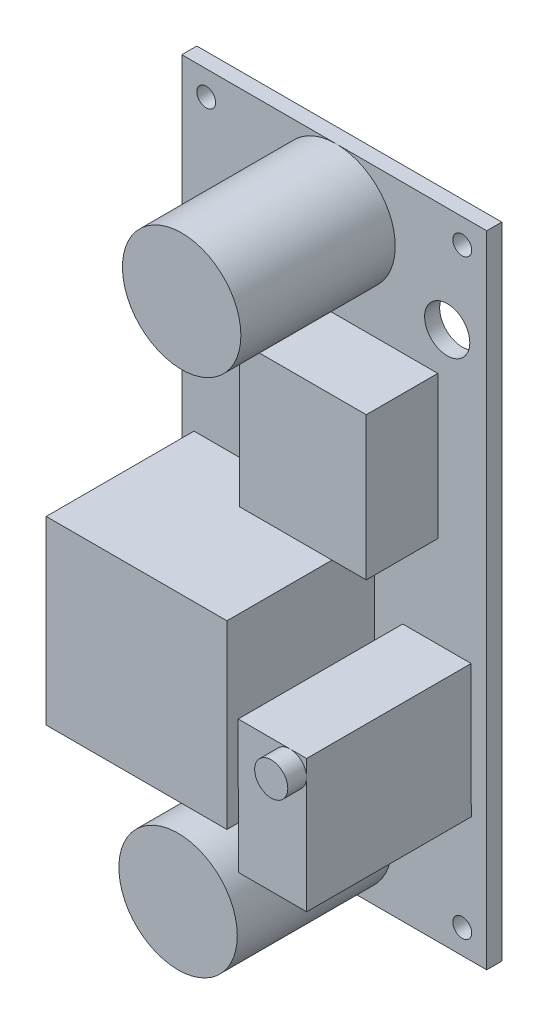
from build123d import *

# Parameters (mm, degrees)
SKETCH1_W           = 20.574
SKETCH1_H           = 43.18
BOSS_EXTRUDE1_DEPTH = 1.016
SKETCH2_R           = 1.524
CUT_EXTRUDE1_DEPTH  = 48.841761381
SKETCH3_R           = 0.635
CUT_EXTRUDE2_DEPTH  = 2.54
SKETCH4_W           = 0.79375
SKETCH4_H           = 0.071233975
SKETCH4_W_2         = 0.081410257
SKETCH4_H_2         = 0.305288462
SKETCH4_H_3         = 0.071233974
BOSS_EXTRUDE2_DEPTH = 0.00254
SKETCH5_W           = 12.192
SKETCH5_H           = 12.192
BOSS_EXTRUDE3_DEPTH = 9.9695
SKETCH6_R           = 3.99415
BOSS_EXTRUDE4_DEPTH = 10.414
BOSS_EXTRUDE5_DEPTH = 11.0998
SKETCH8_R           = 1.1176
BOSS_EXTRUDE6_DEPTH = 1.27
SKETCH9_W           = 8.5344
SKETCH9_H           = 9.652
BOSS_EXTRUDE7_DEPTH = 4.826


with BuildPart() as part:
    # Sketch1 → Boss-Extrude1 (new body)
    with BuildSketch(Plane.XY):
        with Locations((10.287, 21.59)):
            Rectangle(SKETCH1_W, SKETCH1_H)
    extrude(amount=BOSS_EXTRUDE1_DEPTH)

    # Sketch2 → Cut-Extrude1 (cut, through all)
    with BuildSketch(Plane.XY.offset(1.016)):
        with Locations((17.907, 36.068)):
            Circle(SKETCH2_R)
        with Locations((3.0988, 6.35)):
            Circle(SKETCH2_R)
    extrude(amount=-CUT_EXTRUDE1_DEPTH, mode=Mode.SUBTRACT)

    # Sketch3 → Cut-Extrude2 (cut)
    with BuildSketch(Plane.XY.offset(1.016)):
        with Locations((18.923, 41.529)):
            Circle(SKETCH3_R)
        with Locations((18.923, 1.651)):
            Circle(SKETCH3_R)
        with Locations((1.651, 1.651)):
            Circle(SKETCH3_R)
        with Locations((1.651, 41.529)):
            Circle(SKETCH3_R)
    extrude(amount=-CUT_EXTRUDE2_DEPTH, mode=Mode.SUBTRACT)

    # Sketch4 → Boss-Extrude2 (add)
    # profile 1 of 14: a face of its own
    with BuildSketch(Plane(origin=(0, 0, 0), x_dir=(-1, 0, 0), z_dir=(0, 0, -1))):
        Polygon((-17.848673525, 42.286725962), (-18.082728012, 42.286725962), (-18.082728012, 42.357959936), (-17.848673525, 42.357959936), (-17.848673525, 42.592014423), (-17.777439551, 42.592014423), (-17.777439551, 42.357959936), (-17.543385063, 42.357959936), (-17.543385063, 42.286725962), (-17.777439551, 42.286725962), (-17.777439551, 42.052671474), (-17.848673525, 42.052671474), align=None)
    # profile 2 of 14: a face of its own
    with BuildSketch(Plane(origin=(0, 0, 0), x_dir=(-1, 0, 0), z_dir=(0, 0, -1))):
        Polygon((-17.421269679, 41.279274038), (-18.215019679, 41.279274038), (-18.215019679, 41.294220453), (-17.590291363, 41.818616987), (-18.215019679, 41.818616987), (-18.215019679, 41.889850962), (-17.421269679, 41.889850962), (-17.421269679, 41.873632512), (-18.044566954, 41.350508013), (-17.421269679, 41.350508013), align=None)
    # profile 3 of 14: a face of its own
    with BuildSketch(Plane(origin=(0, 0, 0), x_dir=(-1, 0, 0), z_dir=(0, 0, -1))):
        with Locations((-17.818144679, 41.070660257)):
            Rectangle(SKETCH4_W, SKETCH4_H)
    # profile 4 of 14: a face of its own
    with BuildSketch(Plane(origin=(0, 0, 0), x_dir=(-1, 0, 0), z_dir=(0, 0, -1))):
        with Locations((-2.746900665, 42.32743109)):
            Rectangle(SKETCH4_W_2, SKETCH4_H_2)
    # profile 5 of 14: a face of its own
    with BuildSketch(Plane(origin=(0, 0, 0), x_dir=(-1, 0, 0), z_dir=(0, 0, -1))):
        Polygon((-2.441612203, 41.431918269), (-3.235362203, 41.431918269), (-3.235362203, 41.446864683), (-2.610633888, 41.971261218), (-3.235362203, 41.971261218), (-3.235362203, 42.042495192), (-2.441612203, 42.042495192), (-2.441612203, 42.026276743), (-3.064909479, 41.503152244), (-2.441612203, 41.503152244), align=None)
    # profile 6 of 14: a face of its own
    with BuildSketch(Plane(origin=(0, 0, 0), x_dir=(-1, 0, 0), z_dir=(0, 0, -1))):
        with Locations((-2.838487203, 41.223304487)):
            Rectangle(SKETCH4_W, SKETCH4_H_3)
    # profile 7 of 14: a face of its own
    with BuildSketch(Plane(origin=(0, 0, 0), x_dir=(-1, 0, 0), z_dir=(0, 0, -1))):
        with BuildLine():
            add(Edge.make_bspline(
                [(-18.235372243, 1.075856171), (-18.235006246, 1.090555326), (-18.234287397, 1.11942568), (-18.228603062, 1.161816811), (-18.21924724, 1.202408219), (-18.206034822, 1.241223241), (-18.188906583, 1.278114253), (-18.168100678, 1.313185445), (-18.143490664, 1.346331712), (-18.115437918, 1.377324896), (-18.084715583, 1.405597859), (-18.05182674, 1.430407531), (-18.017184889, 1.451336831), (-17.980788224, 1.468469742), (-17.94272172, 1.481920213), (-17.902772035, 1.491199415), (-17.861200825, 1.497127353), (-17.832846501, 1.497820335), (-17.818462688, 1.498171876)],
                knots=[0, 0, 0, 0, 1.065064174, 2.09187391, 3.093564831, 4.079973196, 5.057907931, 6.036227367, 7.030399151, 8.044883615, 9.061699972, 10.052012555, 11.025713132, 11.989727027, 12.962874294, 13.945865945, 14.957962116, 16, 16, 16, 16], degree=3))
            add(Edge.make_bspline(
                [(-17.818462688, 1.498171876), (-17.804184912, 1.497820217), (-17.776041763, 1.497127054), (-17.734733171, 1.491194605), (-17.695028998, 1.481878809), (-17.65701774, 1.468636278), (-17.620694998, 1.451490219), (-17.586026922, 1.430530108), (-17.553050233, 1.405767522), (-17.522116245, 1.37761462), (-17.493818809, 1.346833758), (-17.468859368, 1.314071317), (-17.447920958, 1.27943039), (-17.430596773, 1.24326996), (-17.417426608, 1.205306084), (-17.407838293, 1.165815025), (-17.401969203, 1.124581624), (-17.401271659, 1.096493068), (-17.400917115, 1.082216348)],
                knots=[0, 0, 0, 0, 1.043748596, 2.057349401, 3.045489418, 4.02252776, 4.995289225, 5.97782527, 6.980224157, 8.006516136, 9.032559198, 10.034193337, 11.013412982, 11.987833483, 12.961212594, 13.946489799, 14.956251404, 16, 16, 16, 16], degree=3))
            add(Edge.make_bspline(
                [(-17.400917115, 1.082216348), (-17.401268493, 1.067832618), (-17.401961155, 1.039478458), (-17.407898723, 0.997854881), (-17.417183626, 0.957877607), (-17.43045273, 0.919660959), (-17.447601638, 0.883183627), (-17.468512274, 0.848374269), (-17.493324251, 0.815372605), (-17.521483456, 0.784452245), (-17.552138433, 0.756160909), (-17.584984773, 0.731495836), (-17.619378064, 0.710580498), (-17.655413752, 0.693489171), (-17.692917633, 0.679958124), (-17.732139877, 0.670726852), (-17.772856872, 0.664754235), (-17.800579815, 0.664065975), (-17.814646582, 0.663716748)],
                knots=[0, 0, 0, 0, 1.053102029, 2.075944431, 3.073151272, 4.055350789, 5.033113405, 6.020478099, 7.024410459, 8.052272461, 9.079885166, 10.07527673, 11.055994387, 12.023226415, 12.992069828, 13.970394897, 14.97016774, 16, 16, 16, 16], degree=3))
            add(Edge.make_bspline(
                [(-17.814646582, 0.663716748), (-17.824088276, 0.663837996), (-17.842852554, 0.664078962), (-17.870716944, 0.666979935), (-17.898133218, 0.671189464), (-17.925023415, 0.677222397), (-17.95132171, 0.68511265), (-17.977209472, 0.694422664), (-18.002424353, 0.705793664), (-18.0270858, 0.718648026), (-18.050809379, 0.7329949), (-18.073233856, 0.748841722), (-18.094547403, 0.765631886), (-18.114197706, 0.784038584), (-18.13275641, 0.80345517), (-18.149938312, 0.824196624), (-18.165898346, 0.846136383), (-18.180281173, 0.869368851), (-18.193289405, 0.893321567), (-18.204452218, 0.918013265), (-18.214033021, 0.943108595), (-18.221798351, 0.968725095), (-18.227928831, 0.994794742), (-18.232103356, 1.021374432), (-18.235011728, 1.048442991), (-18.235251554, 1.06667913), (-18.235372243, 1.075856171)],
                knots=[0, 0, 0, 0, 1.037015668, 2.060948919, 3.074880161, 4.083647147, 5.086022904, 6.090072063, 7.104153813, 8.122640571, 9.144368836, 10.147691507, 11.138137339, 12.123020368, 13.103399296, 14.087645067, 15.080126199, 16.082011238, 17.087798457, 18.072939717, 19.057185487, 20.037253025, 21.01195951, 21.997135196, 22.992090687, 24, 24, 24, 24], degree=3))
        make_face()
        with BuildLine():
            add(Edge.make_bspline(
                [(-18.153961986, 1.079354268), (-18.153870483, 1.071821568), (-18.153688352, 1.056828179), (-18.151276124, 1.034540075), (-18.14786271, 1.012538327), (-18.142905235, 0.990865513), (-18.136492957, 0.96947618), (-18.128759243, 0.948360832), (-18.119411891, 0.927591868), (-18.108899658, 0.907195232), (-18.096959443, 0.887642022), (-18.0842801, 0.868885146), (-18.070390525, 0.851412487), (-18.055591099, 0.83498402), (-18.039753387, 0.819640601), (-18.022981396, 0.805388997), (-18.005202585, 0.792240895), (-17.986490119, 0.780354528), (-17.966948474, 0.769776589), (-17.946951204, 0.760305717), (-17.926263297, 0.752454725), (-17.905013853, 0.746235569), (-17.883296514, 0.740956932), (-17.860992955, 0.737645779), (-17.838180065, 0.735209784), (-17.822762664, 0.735037741), (-17.814964591, 0.734950723)],
                knots=[0, 0, 0, 0, 1.008406545, 2.007172654, 2.999155034, 3.989332444, 4.982025741, 5.988181096, 6.998684226, 8.030553839, 9.059268815, 10.065399129, 11.060956322, 12.046057109, 13.024974577, 14.012068307, 14.991706172, 15.984221787, 16.978487447, 17.966117052, 18.945677757, 19.938371053, 20.93015022, 21.936155317, 22.956113857, 24, 24, 24, 24], degree=3))
            add(Edge.make_bspline(
                [(-17.814964591, 0.734950723), (-17.803498062, 0.735240505), (-17.780939853, 0.735810595), (-17.747878001, 0.740780821), (-17.716073226, 0.748497586), (-17.685715099, 0.759685439), (-17.656668243, 0.773957752), (-17.629045699, 0.791367078), (-17.602855614, 0.812072847), (-17.578292949, 0.835578949), (-17.555882556, 0.861282251), (-17.536183703, 0.888562295), (-17.519604599, 0.917203249), (-17.505744841, 0.947040035), (-17.495303475, 0.978327394), (-17.487858787, 1.010864724), (-17.483033673, 1.044652744), (-17.482565039, 1.067677321), (-17.482327371, 1.079354268)],
                knots=[0, 0, 0, 0, 1.032022337, 2.030307203, 3.003823408, 3.974715386, 4.937372378, 5.913284036, 6.909147208, 7.938749767, 8.970518239, 9.975863271, 10.963918693, 11.946286286, 12.933361397, 13.927862637, 14.949112547, 16, 16, 16, 16], degree=3))
            add(Edge.make_bspline(
                [(-17.482327371, 1.079354268), (-17.482435122, 1.08720324), (-17.482648823, 1.102770107), (-17.484804263, 1.125923461), (-17.488253848, 1.148661836), (-17.493245074, 1.170943221), (-17.499409188, 1.192796808), (-17.507055136, 1.214156657), (-17.516220796, 1.235015675), (-17.526435619, 1.255476429), (-17.538039384, 1.275080784), (-17.550547797, 1.293723885), (-17.564192296, 1.311166441), (-17.57879296, 1.3275872), (-17.594581987, 1.342823088), (-17.611252048, 1.357034115), (-17.629068593, 1.369954882), (-17.647704417, 1.381800954), (-17.667103591, 1.39250796), (-17.687155839, 1.401704885), (-17.707753613, 1.409559249), (-17.728912047, 1.415890756), (-17.750583548, 1.420854682), (-17.772799132, 1.424274425), (-17.795513815, 1.426666705), (-17.810877157, 1.426847011), (-17.818621692, 1.426937902)],
                knots=[0, 0, 0, 0, 1.047334373, 2.07717862, 3.100662057, 4.115010574, 5.122652213, 6.129548646, 7.140165612, 8.16200981, 9.179904151, 10.178566626, 11.156366481, 12.133321541, 13.108841334, 14.082538371, 15.054589433, 16.043660176, 17.028268541, 18.009491307, 18.985652105, 19.968123554, 20.954864208, 21.950389976, 22.966808393, 24, 24, 24, 24], degree=3))
            add(Edge.make_bspline(
                [(-17.818621692, 1.426937902), (-17.826313244, 1.426846935), (-17.841570854, 1.426666486), (-17.864127147, 1.424275604), (-17.886182786, 1.420850937), (-17.907651184, 1.415915466), (-17.928537814, 1.409554092), (-17.948823057, 1.401710179), (-17.968582492, 1.392460659), (-17.987767252, 1.38184521), (-18.00617659, 1.369912738), (-18.023775461, 1.356873697), (-18.040234844, 1.34250397), (-18.055955513, 1.327210359), (-18.07062302, 1.310625173), (-18.084180694, 1.292745516), (-18.097239397, 1.27401657), (-18.108796494, 1.254014793), (-18.119522891, 1.233446289), (-18.128674153, 1.212321281), (-18.136533791, 1.190941465), (-18.142924377, 1.169221362), (-18.14784372, 1.147171237), (-18.151279179, 1.124803914), (-18.153687524, 1.102197468), (-18.153870208, 1.086992831), (-18.153961986, 1.079354268)],
                knots=[0, 0, 0, 0, 1.029877221, 2.042951179, 3.035109885, 4.018542222, 4.991021277, 5.957494829, 6.929429462, 7.911425532, 8.892163142, 9.866273635, 10.842761649, 11.81676864, 12.802607151, 13.805177466, 14.821356543, 15.858816981, 16.897175917, 17.927346774, 18.940346092, 19.946830556, 20.957962087, 21.964146003, 22.97721996, 24, 24, 24, 24], degree=3))
        make_face(mode=Mode.SUBTRACT)
    # profile 8 of 14: a face of its own
    with BuildSketch(Plane(origin=(0, 0, 0), x_dir=(-1, 0, 0), z_dir=(0, 0, -1))):
        with BuildLine():
            Line((-18.215019679, 1.660992389), (-18.215019679, 1.732226364))
            Line((-18.215019679, 1.732226364), (-17.739437497, 1.732226364))
            add(Edge.make_bspline(
                [(-17.739437497, 1.732226364), (-17.73270633, 1.732215763), (-17.719932781, 1.732195646), (-17.701751756, 1.73233002), (-17.685588181, 1.732706341), (-17.67137975, 1.732943595), (-17.659191663, 1.733471401), (-17.648957887, 1.733901851), (-17.64072688, 1.734455334), (-17.635923349, 1.735120523), (-17.633858571, 1.735406452)],
                knots=[0, 0, 0, 0, 1.528628734, 2.90083645, 4.128790002, 5.200304208, 6.127813768, 6.898992206, 7.526736466, 8, 8, 8, 8], degree=3))
            add(Edge.make_bspline(
                [(-17.633858571, 1.735406452), (-17.62635228, 1.736567251), (-17.611861722, 1.738808121), (-17.59124176, 1.744761694), (-17.572623805, 1.752698767), (-17.555587904, 1.76254518), (-17.54024232, 1.774986165), (-17.526469275, 1.790432033), (-17.513953078, 1.808605859), (-17.503040753, 1.829247266), (-17.493977148, 1.851240722), (-17.487195246, 1.87379776), (-17.483044725, 1.896483032), (-17.482565397, 1.911672669), (-17.482327371, 1.919215546)],
                knots=[0, 0, 0, 0, 1.042777144, 2.01303441, 2.939567723, 3.817555404, 4.708046775, 5.641195415, 6.651191522, 7.732783915, 8.843021186, 9.914367358, 10.964315445, 12, 12, 12, 12], degree=3))
            add(Edge.make_bspline(
                [(-17.482327371, 1.919215546), (-17.482569555, 1.925691696), (-17.483052524, 1.938606591), (-17.486080133, 1.957785642), (-17.491429047, 1.976523967), (-17.498715245, 1.994674361), (-17.507675315, 2.011941849), (-17.518409332, 2.027883715), (-17.530912384, 2.042170214), (-17.544769217, 2.055207442), (-17.560384265, 2.066493473), (-17.577380814, 2.076472089), (-17.596212068, 2.084396945), (-17.609438251, 2.088409275), (-17.616209082, 2.090463293)],
                knots=[0, 0, 0, 0, 0.994718802, 1.98369237, 2.973235266, 3.981451368, 4.982709966, 5.955777334, 6.925228988, 7.892833478, 8.871333226, 9.877970804, 10.913677552, 12, 12, 12, 12], degree=3))
            add(Edge.make_bspline(
                [(-17.616209082, 2.090463293), (-17.619009562, 2.091143678), (-17.625250161, 2.092659852), (-17.635800525, 2.094076592), (-17.648248648, 2.095552179), (-17.66268397, 2.096576019), (-17.679058119, 2.097574153), (-17.697456396, 2.098171296), (-17.717811992, 2.098447302), (-17.732017206, 2.098529553), (-17.739437497, 2.098572518)],
                knots=[0, 0, 0, 0, 0.558680831, 1.244966039, 2.062412453, 2.990489873, 4.051219941, 5.244515665, 6.560634259, 8, 8, 8, 8], degree=3))
            Line((-17.739437497, 2.098572518), (-18.215019679, 2.098572518))
            Line((-18.215019679, 2.098572518), (-18.215019679, 2.169806492))
            Line((-18.215019679, 2.169806492), (-17.735621392, 2.169806492))
            add(Edge.make_bspline(
                [(-17.735621392, 2.169806492), (-17.726981225, 2.169748853), (-17.710119415, 2.169636367), (-17.68541078, 2.168661171), (-17.661971884, 2.167105699), (-17.639799097, 2.164909962), (-17.618973411, 2.161993969), (-17.599357652, 2.15878121), (-17.581059969, 2.154618267), (-17.563869254, 2.149791786), (-17.547422608, 2.144353002), (-17.531844499, 2.137185029), (-17.516677396, 2.129144183), (-17.50209113, 2.119684551), (-17.488178375, 2.108801656), (-17.474578981, 2.096912435), (-17.461698248, 2.083597827), (-17.449377313, 2.069251103), (-17.43791884, 2.053968725), (-17.427947371, 2.037652013), (-17.419827892, 2.020391052), (-17.412621693, 2.002594567), (-17.407499711, 1.983835879), (-17.403605234, 1.964348652), (-17.401410977, 1.944017298), (-17.401083131, 1.930191724), (-17.400917115, 1.923190657)],
                knots=[0, 0, 0, 0, 1.316707045, 2.569633854, 3.76780728, 4.896239288, 5.964314126, 6.972204208, 7.924543903, 8.822147865, 9.693191779, 10.560896119, 11.431827672, 12.307838457, 13.206132673, 14.12176355, 15.058527151, 16.026630406, 17.00238624, 17.966538933, 18.934743273, 19.906713913, 20.888635248, 21.892958714, 22.933025263, 24, 24, 24, 24], degree=3))
            add(Edge.make_bspline(
                [(-17.400917115, 1.923190657), (-17.401094965, 1.915554929), (-17.401443906, 1.90057366), (-17.403446527, 1.878499567), (-17.407208976, 1.857334361), (-17.412030737, 1.836871477), (-17.418572259, 1.817308609), (-17.426610044, 1.798651521), (-17.435786396, 1.780685991), (-17.446629704, 1.763816778), (-17.458453601, 1.7479055), (-17.471440856, 1.733445785), (-17.485096846, 1.720070574), (-17.49993579, 1.708369416), (-17.51565392, 1.697899734), (-17.532325166, 1.688892233), (-17.549927179, 1.681155104), (-17.562163091, 1.677162285), (-17.568348755, 1.675143782)],
                knots=[0, 0, 0, 0, 1.138939089, 2.234594419, 3.301501784, 4.342532435, 5.367382236, 6.373123747, 7.370098489, 8.372230273, 9.360297234, 10.323289009, 11.268038109, 12.20748145, 13.137029304, 14.081414587, 15.030090602, 16, 16, 16, 16], degree=3))
            add(Edge.make_bspline(
                [(-17.568348755, 1.675143782), (-17.572574357, 1.673969676), (-17.581739781, 1.671423015), (-17.596908681, 1.668695849), (-17.614374564, 1.666403254), (-17.634138626, 1.664247529), (-17.656216185, 1.662975498), (-17.680597671, 1.661860293), (-17.707312566, 1.660984533), (-17.725921358, 1.660989697), (-17.735621392, 1.660992389)],
                knots=[0, 0, 0, 0, 0.625038921, 1.35572334, 2.194682327, 3.136881307, 4.189498639, 5.346923369, 6.617055217, 8, 8, 8, 8], degree=3))
            Line((-17.735621392, 1.660992389), (-18.215019679, 1.660992389))
        make_face()
    # profile 9 of 14: a face of its own
    with BuildSketch(Plane(origin=(0, 0, 0), x_dir=(-1, 0, 0), z_dir=(0, 0, -1))):
        Polygon((-18.133609422, 2.291921876), (-18.215019679, 2.291921876), (-18.215019679, 2.709149441), (-18.133609422, 2.709149441), (-18.133609422, 2.536152646), (-17.421269679, 2.536152646), (-17.421269679, 2.464918671), (-18.133609422, 2.464918671), align=None)
    # profile 10 of 14: a face of its own
    with BuildSketch(Plane(origin=(0, 0, 0), x_dir=(-1, 0, 0), z_dir=(0, 0, -1))):
        Polygon((-17.848673525, 3.044966748), (-18.082728012, 3.044966748), (-18.082728012, 3.116200723), (-17.848673525, 3.116200723), (-17.848673525, 3.35025521), (-17.777439551, 3.35025521), (-17.777439551, 3.116200723), (-17.543385063, 3.116200723), (-17.543385063, 3.044966748), (-17.777439551, 3.044966748), (-17.777439551, 2.810912261), (-17.848673525, 2.810912261), align=None)
    # profile 11 of 14: a face of its own
    with BuildSketch(Plane(origin=(0, 0, 0), x_dir=(-1, 0, 0), z_dir=(0, 0, -1))):
        with BuildLine():
            add(Edge.make_bspline(
                [(-3.255714767, 1.228500356), (-3.25534877, 1.243199511), (-3.254629921, 1.272069864), (-3.248945586, 1.314460995), (-3.239589764, 1.355052404), (-3.226377347, 1.393867425), (-3.209249107, 1.430758437), (-3.188443202, 1.465829629), (-3.163833189, 1.498975897), (-3.135780442, 1.52996908), (-3.105058107, 1.558242044), (-3.072169264, 1.583051716), (-3.037527413, 1.603981015), (-3.001130748, 1.621113927), (-2.963064244, 1.634564398), (-2.923114559, 1.6438436), (-2.88154335, 1.649771537), (-2.853189025, 1.650464519), (-2.838805212, 1.650816061)],
                knots=[0, 0, 0, 0, 1.065064174, 2.09187391, 3.093564831, 4.079973196, 5.057907931, 6.036227367, 7.030399151, 8.044883615, 9.061699972, 10.052012555, 11.025713132, 11.989727027, 12.962874294, 13.945865945, 14.957962116, 16, 16, 16, 16], degree=3))
            add(Edge.make_bspline(
                [(-2.838805212, 1.650816061), (-2.824527436, 1.650464401), (-2.796384287, 1.649771238), (-2.755075695, 1.64383879), (-2.715371522, 1.634522994), (-2.677360264, 1.621280462), (-2.641037522, 1.604134404), (-2.606369446, 1.583174293), (-2.573392757, 1.558411706), (-2.54245877, 1.530258805), (-2.514161333, 1.499477943), (-2.489201892, 1.466715501), (-2.468263482, 1.432074574), (-2.450939297, 1.395914144), (-2.437769132, 1.357950268), (-2.428180817, 1.31845921), (-2.422311727, 1.277225808), (-2.421614183, 1.249137252), (-2.421259639, 1.234860532)],
                knots=[0, 0, 0, 0, 1.043748596, 2.057349401, 3.045489418, 4.02252776, 4.995289225, 5.97782527, 6.980224157, 8.006516136, 9.032559198, 10.034193337, 11.013412982, 11.987833483, 12.961212594, 13.946489799, 14.956251404, 16, 16, 16, 16], degree=3))
            add(Edge.make_bspline(
                [(-2.421259639, 1.234860532), (-2.421611018, 1.220476803), (-2.422303679, 1.192122643), (-2.428241248, 1.150499065), (-2.43752615, 1.110521791), (-2.450795255, 1.072305144), (-2.467944162, 1.035827811), (-2.488854798, 1.001018453), (-2.513666775, 0.96801679), (-2.54182598, 0.937096429), (-2.572480957, 0.908805093), (-2.605327297, 0.884140021), (-2.639720588, 0.863224682), (-2.675756277, 0.846133355), (-2.713260158, 0.832602308), (-2.752482402, 0.823371037), (-2.793199397, 0.817398419), (-2.82092234, 0.816710159), (-2.834989106, 0.816360933)],
                knots=[0, 0, 0, 0, 1.053102029, 2.075944431, 3.073151272, 4.055350789, 5.033113405, 6.020478099, 7.024410459, 8.052272461, 9.079885166, 10.07527673, 11.055994387, 12.023226415, 12.992069828, 13.970394897, 14.97016774, 16, 16, 16, 16], degree=3))
            add(Edge.make_bspline(
                [(-2.834989106, 0.816360933), (-2.844430801, 0.81648218), (-2.863195079, 0.816723146), (-2.891059468, 0.819624119), (-2.918475743, 0.823833648), (-2.94536594, 0.829866582), (-2.971664234, 0.837756835), (-2.997551997, 0.847066848), (-3.022766877, 0.858437849), (-3.047428325, 0.87129221), (-3.071151903, 0.885639084), (-3.09357638, 0.901485906), (-3.114889928, 0.91827607), (-3.13454023, 0.936682768), (-3.153098935, 0.956099355), (-3.170280836, 0.976840808), (-3.18624087, 0.998780567), (-3.200623697, 1.022013036), (-3.21363193, 1.045965752), (-3.224794742, 1.070657449), (-3.234375546, 1.095752779), (-3.242140876, 1.12136928), (-3.248271355, 1.147438926), (-3.25244588, 1.174018617), (-3.255354252, 1.201087176), (-3.255594078, 1.219323314), (-3.255714767, 1.228500356)],
                knots=[0, 0, 0, 0, 1.037015668, 2.060948919, 3.074880161, 4.083647147, 5.086022904, 6.090072063, 7.104153813, 8.122640571, 9.144368836, 10.147691507, 11.138137339, 12.123020368, 13.103399296, 14.087645067, 15.080126199, 16.082011238, 17.087798457, 18.072939717, 19.057185487, 20.037253025, 21.01195951, 21.997135196, 22.992090687, 24, 24, 24, 24], degree=3))
        make_face()
        with BuildLine():
            add(Edge.make_bspline(
                [(-3.174304511, 1.231998453), (-3.174213008, 1.224465752), (-3.174030876, 1.209472364), (-3.171618649, 1.187184259), (-3.168205234, 1.165182512), (-3.163247759, 1.143509697), (-3.156835481, 1.122120364), (-3.149101767, 1.101005017), (-3.139754415, 1.080236052), (-3.129242182, 1.059839417), (-3.117301967, 1.040286206), (-3.104622625, 1.02152933), (-3.090733049, 1.004056671), (-3.075933623, 0.987628204), (-3.060095911, 0.972284785), (-3.043323921, 0.958033181), (-3.025545109, 0.94488508), (-3.006832643, 0.932998712), (-2.987290999, 0.922420773), (-2.967293728, 0.912949901), (-2.946605821, 0.905098909), (-2.925356377, 0.898879754), (-2.903639038, 0.893601116), (-2.881335479, 0.890289964), (-2.858522589, 0.887853968), (-2.843105188, 0.887681926), (-2.835307115, 0.887594907)],
                knots=[0, 0, 0, 0, 1.008406545, 2.007172654, 2.999155034, 3.989332444, 4.982025741, 5.988181096, 6.998684226, 8.030553839, 9.059268815, 10.065399129, 11.060956322, 12.046057109, 13.024974577, 14.012068307, 14.991706172, 15.984221787, 16.978487447, 17.966117052, 18.945677757, 19.938371053, 20.93015022, 21.936155317, 22.956113857, 24, 24, 24, 24], degree=3))
            add(Edge.make_bspline(
                [(-2.835307115, 0.887594907), (-2.823840586, 0.887884689), (-2.801282377, 0.88845478), (-2.768220525, 0.893425005), (-2.736415751, 0.901141771), (-2.706057623, 0.912329623), (-2.677010767, 0.926601937), (-2.649388223, 0.944011262), (-2.623198139, 0.964717031), (-2.598635473, 0.988223133), (-2.576225081, 1.013926436), (-2.556526228, 1.041206479), (-2.539947124, 1.069847433), (-2.526087365, 1.099684219), (-2.515646, 1.130971578), (-2.508201311, 1.163508908), (-2.503376197, 1.197296928), (-2.502907563, 1.220321505), (-2.502669895, 1.231998453)],
                knots=[0, 0, 0, 0, 1.032022337, 2.030307203, 3.003823408, 3.974715386, 4.937372378, 5.913284036, 6.909147208, 7.938749767, 8.970518239, 9.975863271, 10.963918693, 11.946286286, 12.933361397, 13.927862637, 14.949112547, 16, 16, 16, 16], degree=3))
            add(Edge.make_bspline(
                [(-2.502669895, 1.231998453), (-2.502777646, 1.239847424), (-2.502991348, 1.255414292), (-2.505146787, 1.278567645), (-2.508596373, 1.30130602), (-2.513587598, 1.323587405), (-2.519751712, 1.345440992), (-2.527397661, 1.366800842), (-2.53656332, 1.387659859), (-2.546778144, 1.408120614), (-2.558381908, 1.427724969), (-2.570890322, 1.446368069), (-2.584534821, 1.463810625), (-2.599135484, 1.480231384), (-2.614924511, 1.495467272), (-2.631594572, 1.509678299), (-2.649411117, 1.522599066), (-2.668046941, 1.534445138), (-2.687446115, 1.545152145), (-2.707498363, 1.554349069), (-2.728096137, 1.562203433), (-2.749254572, 1.568534941), (-2.770926072, 1.573498866), (-2.793141656, 1.576918609), (-2.815856339, 1.57931089), (-2.831219681, 1.579491196), (-2.838964216, 1.579582087)],
                knots=[0, 0, 0, 0, 1.047334373, 2.07717862, 3.100662057, 4.115010574, 5.122652213, 6.129548646, 7.140165612, 8.16200981, 9.179904151, 10.178566626, 11.156366481, 12.133321541, 13.108841334, 14.082538371, 15.054589433, 16.043660176, 17.028268541, 18.009491307, 18.985652105, 19.968123554, 20.954864208, 21.950389976, 22.966808393, 24, 24, 24, 24], degree=3))
            add(Edge.make_bspline(
                [(-2.838964216, 1.579582087), (-2.846655768, 1.57949112), (-2.861913378, 1.579310671), (-2.884469671, 1.576919788), (-2.90652531, 1.573495122), (-2.927993708, 1.56855965), (-2.948880338, 1.562198277), (-2.969165581, 1.554354363), (-2.988925016, 1.545104843), (-3.008109776, 1.534489394), (-3.026519114, 1.522556923), (-3.044117985, 1.509517881), (-3.060577369, 1.495148154), (-3.076298037, 1.479854543), (-3.090965544, 1.463269357), (-3.104523218, 1.445389701), (-3.117581921, 1.426660755), (-3.129139018, 1.406658978), (-3.139865415, 1.386090473), (-3.149016677, 1.364965465), (-3.156876316, 1.343585649), (-3.163266901, 1.321865546), (-3.168186245, 1.299815421), (-3.171621703, 1.277448099), (-3.174030048, 1.254841652), (-3.174212733, 1.239637016), (-3.174304511, 1.231998453)],
                knots=[0, 0, 0, 0, 1.029877221, 2.042951179, 3.035109885, 4.018542222, 4.991021277, 5.957494829, 6.929429462, 7.911425532, 8.892163142, 9.866273635, 10.842761649, 11.81676864, 12.802607151, 13.805177466, 14.821356543, 15.858816981, 16.897175917, 17.927346774, 18.940346092, 19.946830556, 20.957962087, 21.964146003, 22.97721996, 24, 24, 24, 24], degree=3))
        make_face(mode=Mode.SUBTRACT)
    # profile 12 of 14: a face of its own
    with BuildSketch(Plane(origin=(0, 0, 0), x_dir=(-1, 0, 0), z_dir=(0, 0, -1))):
        with BuildLine():
            Line((-3.235362203, 1.813636574), (-3.235362203, 1.884870548))
            Line((-3.235362203, 1.884870548), (-2.759780022, 1.884870548))
            add(Edge.make_bspline(
                [(-2.759780022, 1.884870548), (-2.753048855, 1.884859947), (-2.740275306, 1.88483983), (-2.72209428, 1.884974204), (-2.705930705, 1.885350525), (-2.691722274, 1.885587779), (-2.679534187, 1.886115585), (-2.669300411, 1.886546035), (-2.661069404, 1.887099518), (-2.656265873, 1.887764707), (-2.654201095, 1.888050636)],
                knots=[0, 0, 0, 0, 1.528628734, 2.90083645, 4.128790002, 5.200304208, 6.127813768, 6.898992206, 7.526736466, 8, 8, 8, 8], degree=3))
            add(Edge.make_bspline(
                [(-2.654201095, 1.888050636), (-2.646694804, 1.889211435), (-2.632204247, 1.891452305), (-2.611584284, 1.897405879), (-2.592966329, 1.905342951), (-2.575930428, 1.915189364), (-2.560584844, 1.927630349), (-2.546811799, 1.943076217), (-2.534295602, 1.961250043), (-2.523383278, 1.98189145), (-2.514319673, 2.003884906), (-2.50753777, 2.026441945), (-2.50338725, 2.049127216), (-2.502907921, 2.064316853), (-2.502669895, 2.071859731)],
                knots=[0, 0, 0, 0, 1.042777144, 2.01303441, 2.939567723, 3.817555404, 4.708046775, 5.641195415, 6.651191522, 7.732783915, 8.843021186, 9.914367358, 10.964315445, 12, 12, 12, 12], degree=3))
            add(Edge.make_bspline(
                [(-2.502669895, 2.071859731), (-2.502912079, 2.07833588), (-2.503395048, 2.091250775), (-2.506422657, 2.110429826), (-2.511771571, 2.129168152), (-2.519057769, 2.147318546), (-2.528017839, 2.164586034), (-2.538751857, 2.180527899), (-2.551254909, 2.194814399), (-2.565111741, 2.207851626), (-2.580726789, 2.219137657), (-2.597723338, 2.229116274), (-2.616554592, 2.237041129), (-2.629780776, 2.24105346), (-2.636551606, 2.243107477)],
                knots=[0, 0, 0, 0, 0.994718802, 1.98369237, 2.973235266, 3.981451368, 4.982709966, 5.955777334, 6.925228988, 7.892833478, 8.871333226, 9.877970804, 10.913677552, 12, 12, 12, 12], degree=3))
            add(Edge.make_bspline(
                [(-2.636551606, 2.243107477), (-2.639352086, 2.243787863), (-2.645592685, 2.245304036), (-2.656143049, 2.246720776), (-2.668591173, 2.248196364), (-2.683026494, 2.249220203), (-2.699400644, 2.250218337), (-2.71779892, 2.250815481), (-2.738154516, 2.251091486), (-2.75235973, 2.251173737), (-2.759780022, 2.251216702)],
                knots=[0, 0, 0, 0, 0.558680831, 1.244966039, 2.062412453, 2.990489873, 4.051219941, 5.244515665, 6.560634259, 8, 8, 8, 8], degree=3))
            Line((-2.759780022, 2.251216702), (-3.235362203, 2.251216702))
            Line((-3.235362203, 2.251216702), (-3.235362203, 2.322450676))
            Line((-3.235362203, 2.322450676), (-2.755963916, 2.322450676))
            add(Edge.make_bspline(
                [(-2.755963916, 2.322450676), (-2.747323749, 2.322393037), (-2.730461939, 2.322280551), (-2.705753304, 2.321305356), (-2.682314408, 2.319749883), (-2.660141621, 2.317554146), (-2.639315936, 2.314638153), (-2.619700177, 2.311425394), (-2.601402493, 2.307262452), (-2.584211778, 2.302435971), (-2.567765132, 2.296997186), (-2.552187023, 2.289829213), (-2.53701992, 2.281788367), (-2.522433655, 2.272328735), (-2.508520899, 2.261445841), (-2.494921506, 2.24955662), (-2.482040773, 2.236242011), (-2.469719837, 2.221895288), (-2.458261364, 2.206612909), (-2.448289895, 2.190296198), (-2.440170416, 2.173035236), (-2.432964218, 2.155238752), (-2.427842235, 2.136480063), (-2.423947758, 2.116992836), (-2.421753501, 2.096661483), (-2.421425655, 2.082835908), (-2.421259639, 2.075834841)],
                knots=[0, 0, 0, 0, 1.316707045, 2.569633854, 3.76780728, 4.896239288, 5.964314126, 6.972204208, 7.924543903, 8.822147865, 9.693191779, 10.560896119, 11.431827672, 12.307838457, 13.206132673, 14.12176355, 15.058527151, 16.026630406, 17.00238624, 17.966538933, 18.934743273, 19.906713913, 20.888635248, 21.892958714, 22.933025263, 24, 24, 24, 24], degree=3))
            add(Edge.make_bspline(
                [(-2.421259639, 2.075834841), (-2.421437489, 2.068199114), (-2.421786431, 2.053217844), (-2.423789051, 2.031143751), (-2.4275515, 2.009978546), (-2.432373262, 1.989515662), (-2.438914783, 1.969952793), (-2.446952568, 1.951295705), (-2.456128921, 1.933330175), (-2.466972228, 1.916460963), (-2.478796126, 1.900549684), (-2.49178338, 1.88608997), (-2.505439371, 1.872714759), (-2.520278314, 1.861013601), (-2.535996444, 1.850543918), (-2.55266769, 1.841536417), (-2.570269703, 1.833799288), (-2.582505615, 1.82980647), (-2.58869128, 1.827787966)],
                knots=[0, 0, 0, 0, 1.138939089, 2.234594419, 3.301501784, 4.342532435, 5.367382236, 6.373123747, 7.370098489, 8.372230273, 9.360297234, 10.323289009, 11.268038109, 12.20748145, 13.137029304, 14.081414587, 15.030090602, 16, 16, 16, 16], degree=3))
            add(Edge.make_bspline(
                [(-2.58869128, 1.827787966), (-2.592916881, 1.82661386), (-2.602082305, 1.824067199), (-2.617251206, 1.821340034), (-2.634717089, 1.819047438), (-2.65448115, 1.816891714), (-2.676558709, 1.815619682), (-2.700940196, 1.814504477), (-2.727655091, 1.813628717), (-2.746263882, 1.813633882), (-2.755963916, 1.813636574)],
                knots=[0, 0, 0, 0, 0.625038921, 1.35572334, 2.194682327, 3.136881307, 4.189498639, 5.346923369, 6.617055217, 8, 8, 8, 8], degree=3))
            Line((-2.755963916, 1.813636574), (-3.235362203, 1.813636574))
        make_face()
    # profile 13 of 14: a face of its own
    with BuildSketch(Plane(origin=(0, 0, 0), x_dir=(-1, 0, 0), z_dir=(0, 0, -1))):
        Polygon((-3.153951947, 2.444566061), (-3.235362203, 2.444566061), (-3.235362203, 2.861793625), (-3.153951947, 2.861793625), (-3.153951947, 2.68879683), (-2.441612203, 2.68879683), (-2.441612203, 2.617562856), (-3.153951947, 2.617562856), align=None)
    # profile 14 of 14: a face of its own
    with BuildSketch(Plane(origin=(0, 0, 0), x_dir=(-1, 0, 0), z_dir=(0, 0, -1))):
        with Locations((-2.746900665, 3.08567183)):
            Rectangle(SKETCH4_W_2, SKETCH4_H_2)
    extrude(amount=BOSS_EXTRUDE2_DEPTH)

    # Sketch5 → Boss-Extrude3 (add)
    with BuildSketch(Plane.XY.offset(1.016)):
        with Locations((6.9215, 15.5067)):
            Rectangle(SKETCH5_W, SKETCH5_H)
    extrude(amount=BOSS_EXTRUDE3_DEPTH)

    # Sketch6 → Boss-Extrude4 (add)
    with BuildSketch(Plane.XY.offset(1.016)):
        with Locations(Location((10.40765, 39.18585, 0), (0, 0, 90))):
            Circle(SKETCH6_R)
        with Locations(Location((10.16635, 3.99415, 0), (0, 0, 270))):
            Circle(SKETCH6_R)
    extrude(amount=BOSS_EXTRUDE4_DEPTH)

    # Sketch7 → Boss-Extrude5 (add)
    with BuildSketch(Plane.XY.offset(1.016)):
        Polygon((14.90729124, 17.374447806), (19.521438347, 17.374447806), (19.530013473, 8.4201), (14.915866367, 8.4201), align=None)
    extrude(amount=BOSS_EXTRUDE5_DEPTH)

    # Sketch8 → Boss-Extrude6 (add)
    with BuildSketch(Plane.XY.offset(12.1158)):
        with Locations(Location((18.404908616, 16.256847806, 0), (0, 0, 90))):
            Circle(SKETCH8_R)
    extrude(amount=BOSS_EXTRUDE6_DEPTH)

    # Sketch9 → Boss-Extrude7 (add)
    with BuildSketch(Plane.XY.offset(1.016)):
        with Locations((13.0048, 28.3718)):
            Rectangle(SKETCH9_W, SKETCH9_H)
    extrude(amount=BOSS_EXTRUDE7_DEPTH)


solid = part.part
